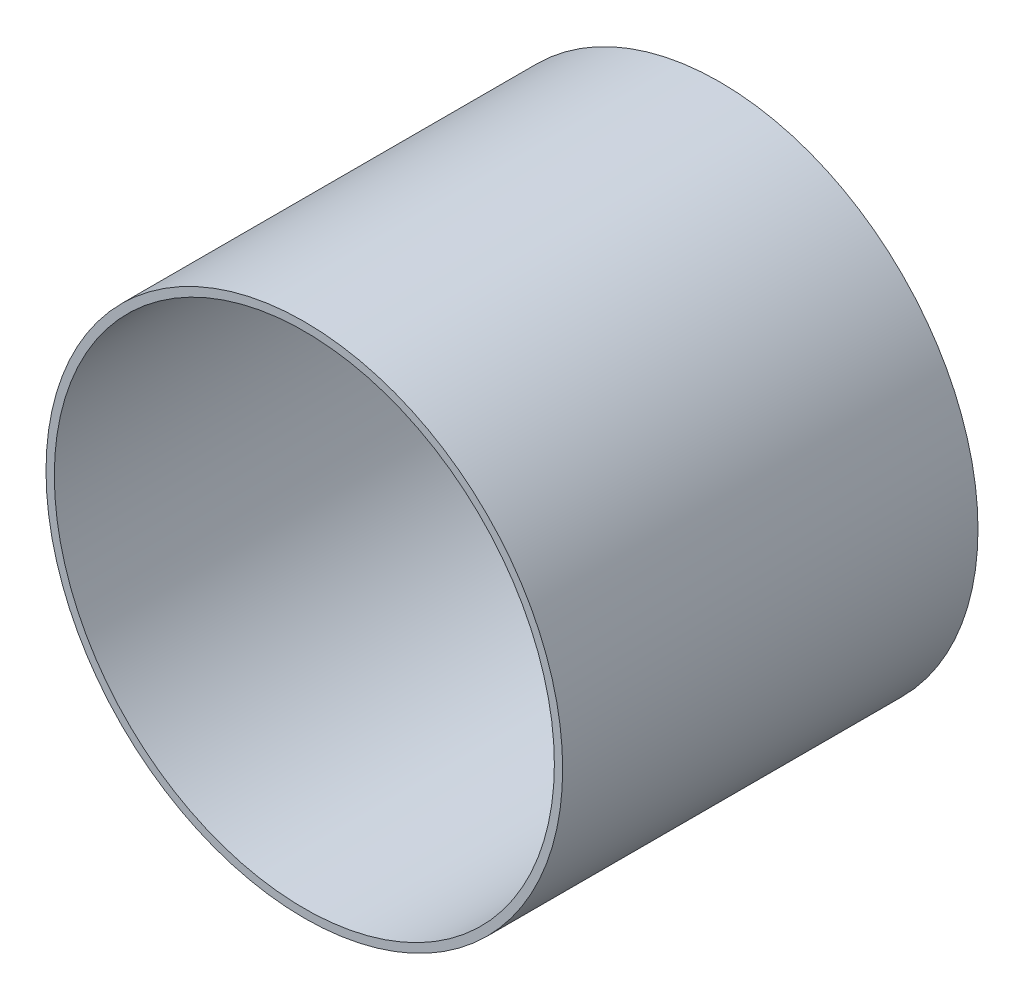
from build123d import *

# Parameters (mm, degrees)
SKETCH_1_R      = 31.1
SKETCH_1_R_2    = 30.1
EXTRUDE_1_DEPTH = 50


with BuildPart() as part:
    # Эскиз1 → Бобышка-Вытянуть1 (new body)
    with BuildSketch(Plane.XY):
        Circle(SKETCH_1_R)
        Circle(SKETCH_1_R_2, mode=Mode.SUBTRACT)
    extrude(amount=EXTRUDE_1_DEPTH)


solid = part.part
